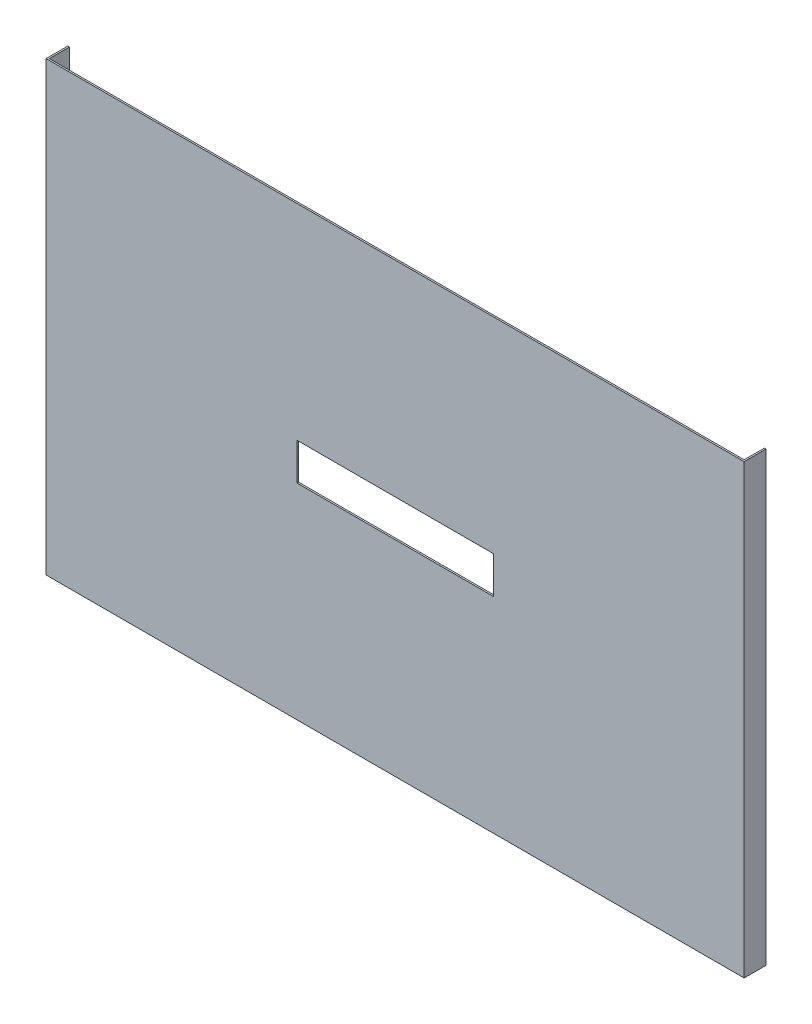
from build123d import *

# Parameters (mm, degrees)
TOPPING_KLAPE_KAT3_KAPAK_1_START = 740
TOPPING_KLAPE_KAT3_KAPAK_1_DEPTH = 410
TOPPING_KLAPE_KAT3_KAPAK_2_START = 27
SKETCH2_W                        = 180
SKETCH2_H                        = 34
TOPPING_KLAPE_KAT3_KAPAK_2_DEPTH = 14


with BuildPart() as part:
    # Sketch1 → TOPPING_klape_kat3_kapak_1 (new body)
    with BuildSketch(Plane(origin=(0, 0, 0), x_dir=(1, 0, 0), z_dir=(0, 1, 0)).offset(TOPPING_KLAPE_KAT3_KAPAK_1_START)):
        Polygon((30, -40), (30, -20), (31.5, -20), (31.5, -38.5), (668.5, -38.5), (668.5, -20), (670, -20), (670, -40), align=None)
    extrude(amount=TOPPING_KLAPE_KAT3_KAPAK_1_DEPTH)

    # Sketch2 → TOPPING_klape_kat3_kapak_2 (cut)
    with BuildSketch(Plane.XY.offset(TOPPING_KLAPE_KAT3_KAPAK_2_START)):
        with Locations((350, 945)):
            Rectangle(SKETCH2_W, SKETCH2_H)
    extrude(amount=TOPPING_KLAPE_KAT3_KAPAK_2_DEPTH, mode=Mode.SUBTRACT)


solid = part.part
